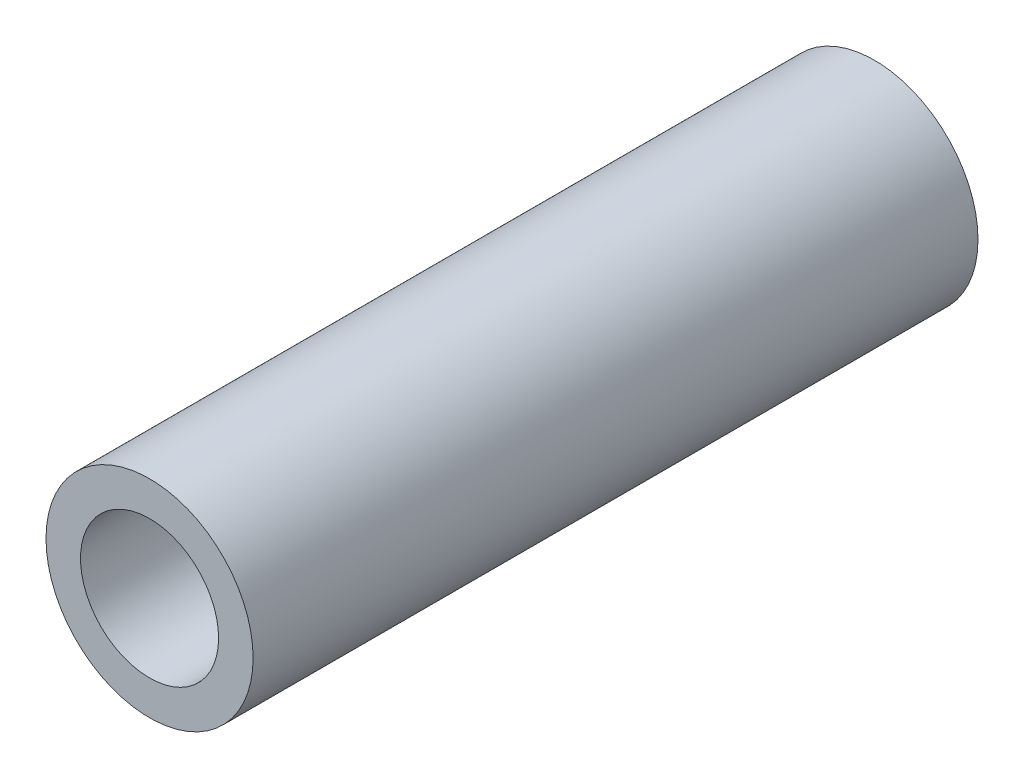
from build123d import *

# Parameters (mm, degrees)
SZKIC1_R                    = 9
SZKIC1_R_2                  = 6
DODANIE_WYCI_GNI_CIE1_DEPTH = 63


with BuildPart() as part:
    # Szkic1 → Dodanie-wyciągnięcie1 (new body)
    with BuildSketch(Plane.XY):
        Circle(SZKIC1_R)
        Circle(SZKIC1_R_2, mode=Mode.SUBTRACT)
    extrude(amount=DODANIE_WYCI_GNI_CIE1_DEPTH)


solid = part.part
